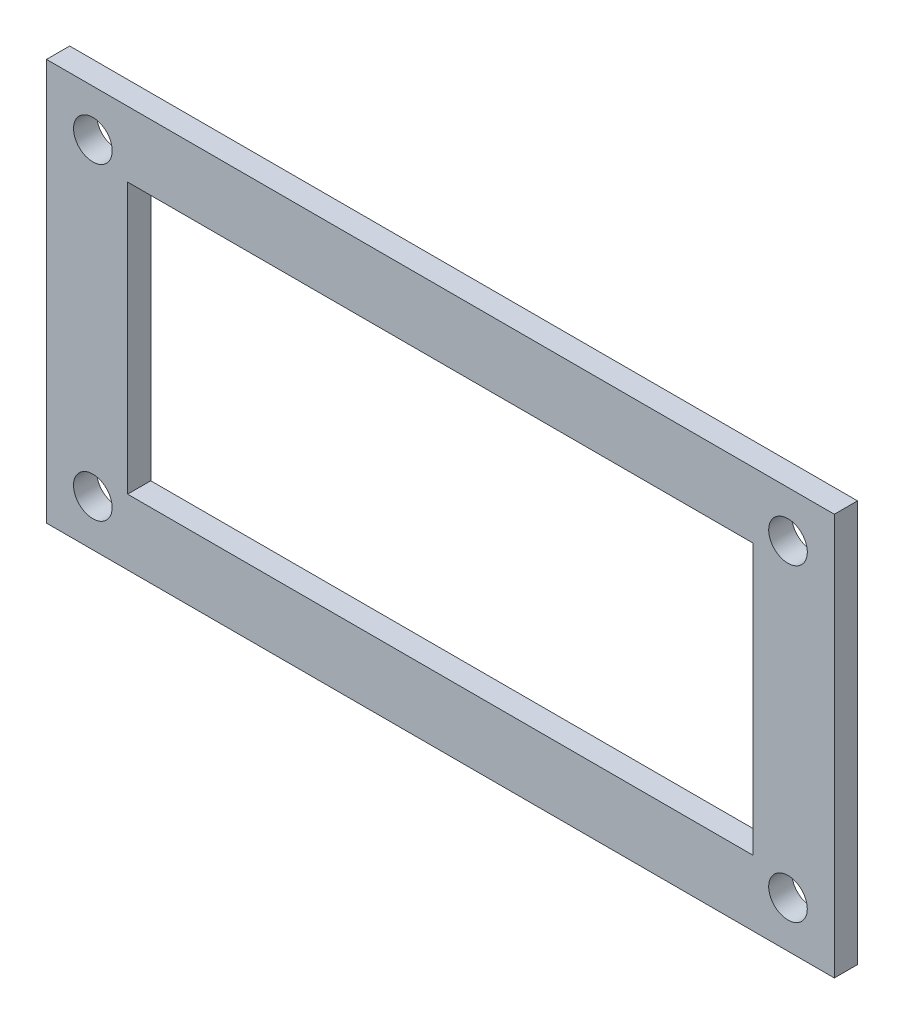
from build123d import *

# Parameters (mm, degrees)
SKETCH1_W           = 102
SKETCH1_H           = 52
SKETCH1_R           = 2.5
SKETCH1_W_2         = 81
SKETCH1_H_2         = 35
BOSS_EXTRUDE1_DEPTH = 3


with BuildPart() as part:
    # Sketch1 → Boss-Extrude1 (new body)
    with BuildSketch(Plane.XY):
        Rectangle(SKETCH1_W, SKETCH1_H)
        with Locations((-45, 20)):
            Circle(SKETCH1_R, mode=Mode.SUBTRACT)
        with Locations(Location((-45, -20, 0), (0, 0, 180))):
            Circle(SKETCH1_R, mode=Mode.SUBTRACT)
        with Locations((45, -20)):
            Circle(SKETCH1_R, mode=Mode.SUBTRACT)
        with Locations(Location((45, 20, 0), (0, 0, 180))):
            Circle(SKETCH1_R, mode=Mode.SUBTRACT)
        Rectangle(SKETCH1_W_2, SKETCH1_H_2, mode=Mode.SUBTRACT)
    extrude(amount=BOSS_EXTRUDE1_DEPTH)


solid = part.part
